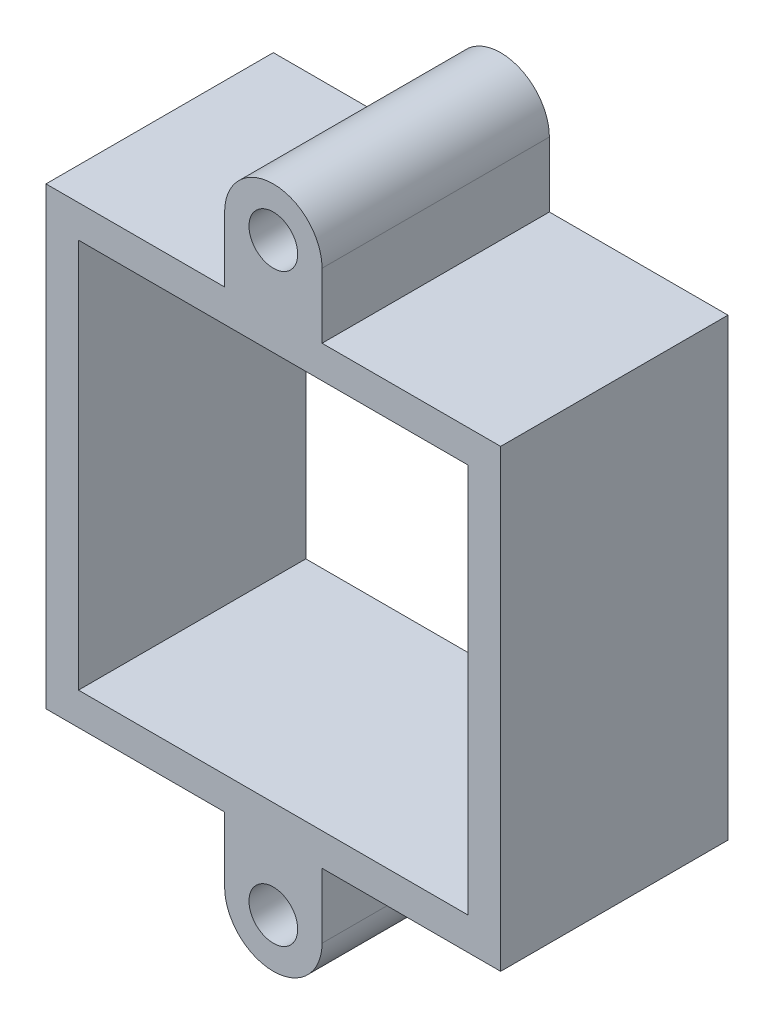
from build123d import *

# Parameters (mm, degrees)
SKETCH_1_W          = 14
SKETCH_1_H          = 14
SKETCH_1_W_2        = 12
SKETCH_1_H_2        = 12
EXTRUDE_1_DEPTH     = 7
SKETCH_2_W          = 3
SKETCH_2_H          = 7
EXTRUDE_2_DEPTH     = 3.5
SKETCH_3_R          = 0.75
CUT_EXTRUDE_1_DEPTH = 15.43086969
CUT_EXTRUDE_2_DEPTH = 15.43086969


with BuildPart() as part:
    # 草图1 → 凸台-拉伸1 (new body)
    with BuildSketch(Plane.XY):
        Rectangle(SKETCH_1_W, SKETCH_1_H)
        Rectangle(SKETCH_1_W_2, SKETCH_1_H_2, mode=Mode.SUBTRACT)
    extrude(amount=EXTRUDE_1_DEPTH)

    # 草图2 → 凸台-拉伸2 (add)
    with BuildSketch(Plane.XZ.offset(7)):
        with Locations((0, 3.5)):
            Rectangle(SKETCH_2_W, SKETCH_2_H)
    extrude_2 = extrude(amount=EXTRUDE_2_DEPTH)

    # 草图3 → 切除-拉伸1 (cut, through all)
    with BuildSketch(Plane.XY.offset(7)):
        with Locations((0, -9)):
            Circle(SKETCH_3_R)
    cut_extrude_1 = extrude(amount=-CUT_EXTRUDE_1_DEPTH, mode=Mode.SUBTRACT)

    # 草图3<3> → 切除-拉伸2 (cut, through all)
    with BuildSketch(Plane.XY.offset(7)):
        with BuildLine():
            ThreePointArc((0, -10.5), (-1.060660172, -10.060660172), (-1.5, -9))
            Line((-1.5, -9), (-1.5, -10.5))
            Line((-1.5, -10.5), (0, -10.5))
        make_face()
        with BuildLine():
            Line((1.5, -10.5), (1.5, -9))
            ThreePointArc((1.5, -9), (1.060660172, -10.060660172), (0, -10.5))
            Line((0, -10.5), (1.5, -10.5))
        make_face()
    cut_extrude_2 = extrude(amount=-CUT_EXTRUDE_2_DEPTH, mode=Mode.SUBTRACT)

    # 镜向1: 凸台-拉伸2, 切除-拉伸1, 切除-拉伸2 across plane
    add(extrude_2.mirror(Plane.ZX))
    add(cut_extrude_1.mirror(Plane.ZX), mode=Mode.SUBTRACT)
    add(cut_extrude_2.mirror(Plane.ZX), mode=Mode.SUBTRACT)


solid = part.part
